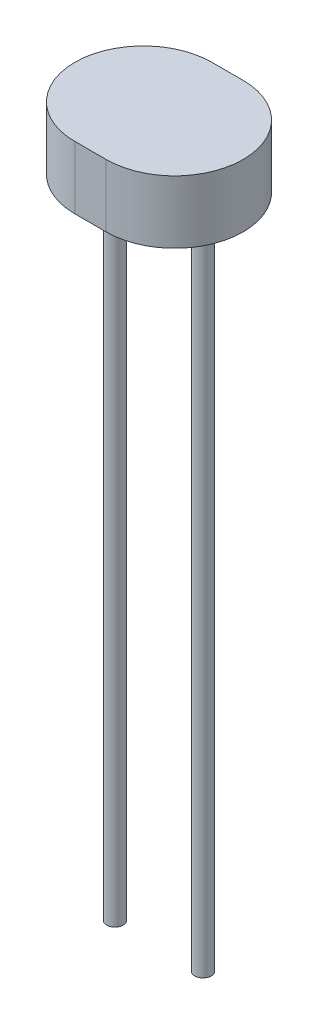
from build123d import *

# Parameters (mm, degrees)
SALIENTE_EXTRUIR1_DEPTH = 1.9
CROQUIS3_R              = 0.25
SALIENTE_EXTRUIR2_DEPTH = 20


with BuildPart() as part:
    # Croquis1 → Saliente-Extruir1 (new body)
    with BuildSketch(Plane(origin=(0, 0, 0), x_dir=(1, 0, 0), z_dir=(0, 1, 0))):
        with BuildLine():
            Line((-0.475, 2.075), (0.475, 2.075))
            ThreePointArc((0.475, 2.075), (2.55, 0), (0.475, -2.075))
            Line((0.475, -2.075), (-0.475, -2.075))
            ThreePointArc((-0.475, -2.075), (-2.55, 0), (-0.475, 2.075))
        make_face()
    extrude(amount=SALIENTE_EXTRUIR1_DEPTH)

    # Croquis3 → Saliente-Extruir2 (add)
    with BuildSketch(Plane.XZ):
        with Locations(Location((-1.333712644, 0, 0), (0, 0, 90))):
            Circle(CROQUIS3_R)
        with Locations(Location((1.333712644, 0, 0), (0, 0, 90))):
            Circle(CROQUIS3_R)
    extrude(amount=SALIENTE_EXTRUIR2_DEPTH)


solid = part.part
